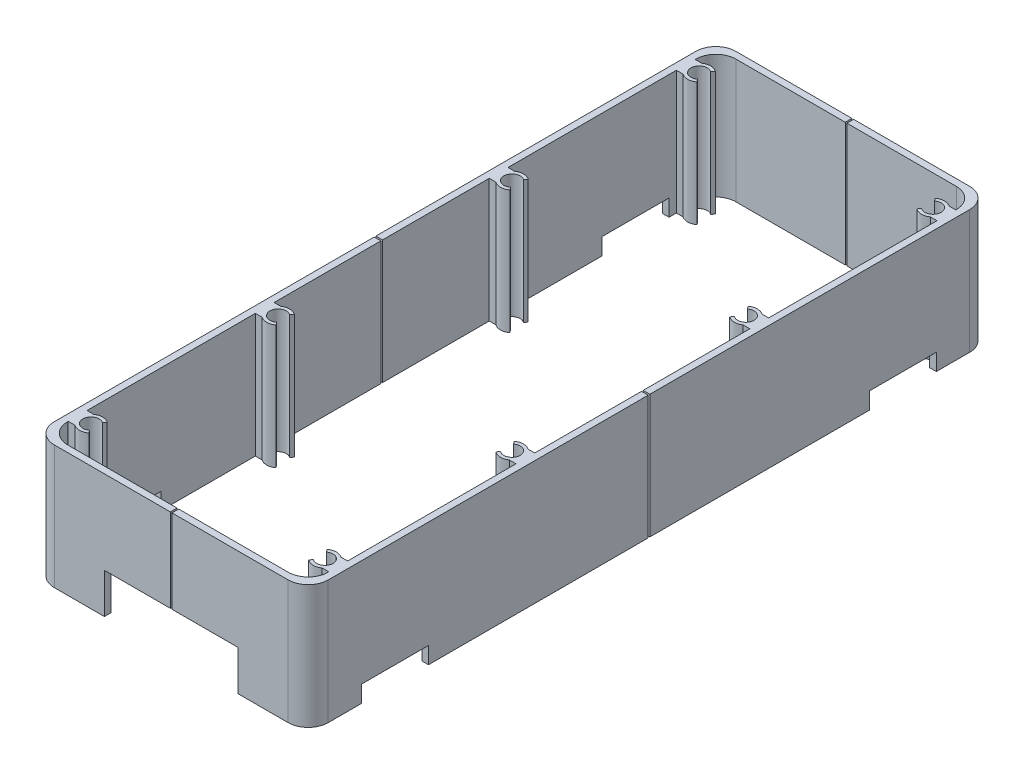
from build123d import *

# Parameters (mm, degrees)
EXTRUDE_2_DEPTH          = 18.5
EXTRUDE_2_2_DEPTH        = 18.5
EXTRUDE_2_3_DEPTH        = 18.5
EXTRUDE_2_4_DEPTH        = 18.5
CUT_EXTRUDE_START        = 100
SKETCH_3_W               = 40
SKETCH_3_H               = 12
CUT_EXTRUDE_2_DEPTH      = 12.477576221
CUT_EXTRUDE_3_DEPTH      = 112.477576221
CUT_EXTRUDE_3_DEPTH_BACK = 112.477576221
SKETCH_4_W               = 20
SKETCH_4_H               = 5


with BuildPart() as part:
    # Эскиз1 → Бобышка-Вытянуть2 (new, symmetric)
    with BuildSketch(Plane(origin=(0, 0, 0), x_dir=(1, 0, 0), z_dir=(0, 1, 0))):
        with BuildLine():
            Line((-39, 93.811138559), (-37, 93.811138559))
            ThreePointArc((-37, 93.811138559), (-34.937686812, 94.44943721), (-32.89977307, 93.737069024))
            Line((-32.89977307, 93.737069024), (-33.508534499, 92.943715684))
            ThreePointArc((-33.508534499, 92.943715684), (-37.45, 91), (-33.508534499, 89.056284316))
            Line((-33.508534499, 89.056284316), (-32.89977307, 88.262930976))
            ThreePointArc((-32.89977307, 88.262930976), (-34.937686812, 87.55056279), (-37, 88.188861441))
            Line((-37, 88.188861441), (-39, 88.188861441))
            Line((-39, 88.188861441), (-39, 37.811138559))
            Line((-39, 37.811138559), (-37, 37.811138559))
            ThreePointArc((-37, 37.811138559), (-34.937686812, 38.44943721), (-32.89977307, 37.737069024))
            Line((-32.89977307, 37.737069024), (-33.508534499, 36.943715684))
            ThreePointArc((-33.508534499, 36.943715684), (-37.45, 35), (-33.508534499, 33.056284316))
            Line((-33.508534499, 33.056284316), (-32.89977307, 32.262930976))
            ThreePointArc((-32.89977307, 32.262930976), (-34.937686812, 31.55056279), (-37, 32.188861441))
            Line((-37, 32.188861441), (-39, 32.188861441))
            Line((-39, 32.188861441), (-39, 0.25))
            Line((-39, 0.25), (-41, 0.25))
            Line((-41, 0.25), (-41, 96))
            ThreePointArc((-41, 96), (-39.242640687, 100.242640687), (-35, 102))
            Line((-35, 102), (-0.25, 102))
            Line((-0.25, 102), (-0.25, 100))
            Line((-0.25, 100), (-33, 100))
            ThreePointArc((-33, 100), (-37.242640687, 98.242640687), (-39, 94))
            Line((-39, 94), (-39, 93.811138559))
        make_face()
    extrude(amount=EXTRUDE_2_DEPTH, both=True)


with BuildPart() as body_2:
    # Эскиз1 → Extrude 2 2 (new, symmetric)
    with BuildSketch(Plane(origin=(0, 0, 0), x_dir=(1, 0, 0), z_dir=(0, 1, 0))):
        with BuildLine():
            Line((-35, -102), (-0.25, -102))
            Line((-0.25, -102), (-0.25, -100))
            Line((-0.25, -100), (-33, -100))
            ThreePointArc((-33, -100), (-37.242640687, -98.242640687), (-39, -94))
            Line((-39, -94), (-39, -93.811138559))
            Line((-39, -93.811138559), (-37, -93.811138559))
            ThreePointArc((-37, -93.811138559), (-34.937686812, -94.44943721), (-32.89977307, -93.737069024))
            Line((-32.89977307, -93.737069024), (-33.508534499, -92.943715684))
            ThreePointArc((-33.508534499, -92.943715684), (-37.45, -91), (-33.508534499, -89.056284316))
            Line((-33.508534499, -89.056284316), (-32.89977307, -88.262930976))
            ThreePointArc((-32.89977307, -88.262930976), (-34.937686812, -87.55056279), (-37, -88.188861441))
            Line((-37, -88.188861441), (-39, -88.188861441))
            Line((-39, -88.188861441), (-39, -37.811138559))
            Line((-39, -37.811138559), (-37, -37.811138559))
            ThreePointArc((-37, -37.811138559), (-34.937686812, -38.44943721), (-32.89977307, -37.737069024))
            Line((-32.89977307, -37.737069024), (-33.508534499, -36.943715684))
            ThreePointArc((-33.508534499, -36.943715684), (-37.45, -35), (-33.508534499, -33.056284316))
            Line((-33.508534499, -33.056284316), (-32.89977307, -32.262930976))
            ThreePointArc((-32.89977307, -32.262930976), (-34.937686812, -31.55056279), (-37, -32.188861441))
            Line((-37, -32.188861441), (-39, -32.188861441))
            Line((-39, -32.188861441), (-39, -0.25))
            Line((-39, -0.25), (-41, -0.25))
            Line((-41, -0.25), (-41, -96))
            ThreePointArc((-41, -96), (-39.242640687, -100.242640687), (-35, -102))
        make_face()
    extrude(amount=EXTRUDE_2_2_DEPTH, both=True)


with BuildPart() as body_3:
    # Эскиз1 → Extrude 2 3 (new, symmetric)
    with BuildSketch(Plane(origin=(0, 0, 0), x_dir=(1, 0, 0), z_dir=(0, 1, 0))):
        with BuildLine():
            Line((41, 96), (41, 0.25))
            Line((41, 0.25), (39, 0.25))
            Line((39, 0.25), (39, 32.188861441))
            Line((39, 32.188861441), (37, 32.188861441))
            ThreePointArc((37, 32.188861441), (34.937686812, 31.55056279), (32.89977307, 32.262930976))
            Line((32.89977307, 32.262930976), (33.508534499, 33.056284316))
            ThreePointArc((33.508534499, 33.056284316), (37.45, 35), (33.508534499, 36.943715684))
            Line((33.508534499, 36.943715684), (32.89977307, 37.737069024))
            ThreePointArc((32.89977307, 37.737069024), (34.937686812, 38.44943721), (37, 37.811138559))
            Line((37, 37.811138559), (39, 37.811138559))
            Line((39, 37.811138559), (39, 88.188861441))
            Line((39, 88.188861441), (37, 88.188861441))
            ThreePointArc((37, 88.188861441), (34.937686812, 87.55056279), (32.89977307, 88.262930976))
            Line((32.89977307, 88.262930976), (33.508534499, 89.056284316))
            ThreePointArc((33.508534499, 89.056284316), (37.45, 91), (33.508534499, 92.943715684))
            Line((33.508534499, 92.943715684), (32.89977307, 93.737069024))
            ThreePointArc((32.89977307, 93.737069024), (34.937686812, 94.44943721), (37, 93.811138559))
            Line((37, 93.811138559), (39, 93.811138559))
            Line((39, 93.811138559), (39, 94))
            ThreePointArc((39, 94), (37.242640687, 98.242640687), (33, 100))
            Line((33, 100), (0.25, 100))
            Line((0.25, 100), (0.25, 102))
            Line((0.25, 102), (35, 102))
            ThreePointArc((35, 102), (39.242640687, 100.242640687), (41, 96))
        make_face()
    extrude(amount=EXTRUDE_2_3_DEPTH, both=True)


with BuildPart() as body_4:
    # Эскиз1 → Extrude 2 4 (new, symmetric)
    with BuildSketch(Plane(origin=(0, 0, 0), x_dir=(1, 0, 0), z_dir=(0, 1, 0))):
        with BuildLine():
            Line((41, -0.25), (39, -0.25))
            Line((39, -0.25), (39, -32.188861441))
            Line((39, -32.188861441), (37, -32.188861441))
            ThreePointArc((37, -32.188861441), (34.937686812, -31.55056279), (32.89977307, -32.262930976))
            Line((32.89977307, -32.262930976), (33.508534499, -33.056284316))
            ThreePointArc((33.508534499, -33.056284316), (37.45, -35), (33.508534499, -36.943715684))
            Line((33.508534499, -36.943715684), (32.89977307, -37.737069024))
            ThreePointArc((32.89977307, -37.737069024), (34.937686812, -38.44943721), (37, -37.811138559))
            Line((37, -37.811138559), (39, -37.811138559))
            Line((39, -37.811138559), (39, -88.188861441))
            Line((39, -88.188861441), (37, -88.188861441))
            ThreePointArc((37, -88.188861441), (34.937686812, -87.55056279), (32.89977307, -88.262930976))
            Line((32.89977307, -88.262930976), (33.508534499, -89.056284316))
            ThreePointArc((33.508534499, -89.056284316), (37.45, -91), (33.508534499, -92.943715684))
            Line((33.508534499, -92.943715684), (32.89977307, -93.737069024))
            ThreePointArc((32.89977307, -93.737069024), (34.937686812, -94.44943721), (37, -93.811138559))
            Line((37, -93.811138559), (39, -93.811138559))
            Line((39, -93.811138559), (39, -94))
            ThreePointArc((39, -94), (37.242640687, -98.242640687), (33, -100))
            Line((33, -100), (0.25, -100))
            Line((0.25, -100), (0.25, -102))
            Line((0.25, -102), (35, -102))
            ThreePointArc((35, -102), (39.242640687, -100.242640687), (41, -96))
            Line((41, -96), (41, -0.25))
        make_face()
    extrude(amount=EXTRUDE_2_4_DEPTH, both=True)


with BuildPart() as cut_extrude_2_tool:
    # Эскиз3 → Вырез-Вытянуть2 (new, through all)
    with BuildSketch(Plane.XY.offset(CUT_EXTRUDE_START)):
        with Locations((0, -12.5)):
            Rectangle(SKETCH_3_W, SKETCH_3_H)
    extrude(amount=CUT_EXTRUDE_2_DEPTH)


with BuildPart() as body_2_1:
    add(body_2.part)

    # Вырез-Вытянуть2: cut by cut_extrude_2_tool
    add(cut_extrude_2_tool.part, mode=Mode.SUBTRACT)


with BuildPart() as body_4_1:
    add(body_4.part)

    # Вырез-Вытянуть2: cut by cut_extrude_2_tool
    add(cut_extrude_2_tool.part, mode=Mode.SUBTRACT)


with BuildPart() as cut_extrude_3_tool:
    # Эскиз4 → Вырез-Вытянуть3 (new, two sides: drawn at the far end of the back side and taken through both)
    with BuildSketch(Plane(origin=(0, 0, 0), x_dir=(0, 0, -1), z_dir=(1, 0, 0)).offset(-CUT_EXTRUDE_3_DEPTH_BACK)):
        with Locations((-76, -16)):
            Rectangle(SKETCH_4_W, SKETCH_4_H)
        with Locations((76, -16)):
            Rectangle(SKETCH_4_W, SKETCH_4_H)
    extrude(amount=CUT_EXTRUDE_3_DEPTH + CUT_EXTRUDE_3_DEPTH_BACK)


with BuildPart() as part_1:
    add(part.part)

    # Вырез-Вытянуть3: cut by cut_extrude_3_tool
    add(cut_extrude_3_tool.part, mode=Mode.SUBTRACT)


with BuildPart() as body_2_2:
    add(body_2_1.part)

    # Вырез-Вытянуть3: cut by cut_extrude_3_tool
    add(cut_extrude_3_tool.part, mode=Mode.SUBTRACT)


with BuildPart() as body_3_1:
    add(body_3.part)

    # Вырез-Вытянуть3: cut by cut_extrude_3_tool
    add(cut_extrude_3_tool.part, mode=Mode.SUBTRACT)


with BuildPart() as body_4_2:
    add(body_4_1.part)

    # Вырез-Вытянуть3: cut by cut_extrude_3_tool
    add(cut_extrude_3_tool.part, mode=Mode.SUBTRACT)


solid = Compound([part_1.part, body_2_2.part, body_3_1.part, body_4_2.part])
